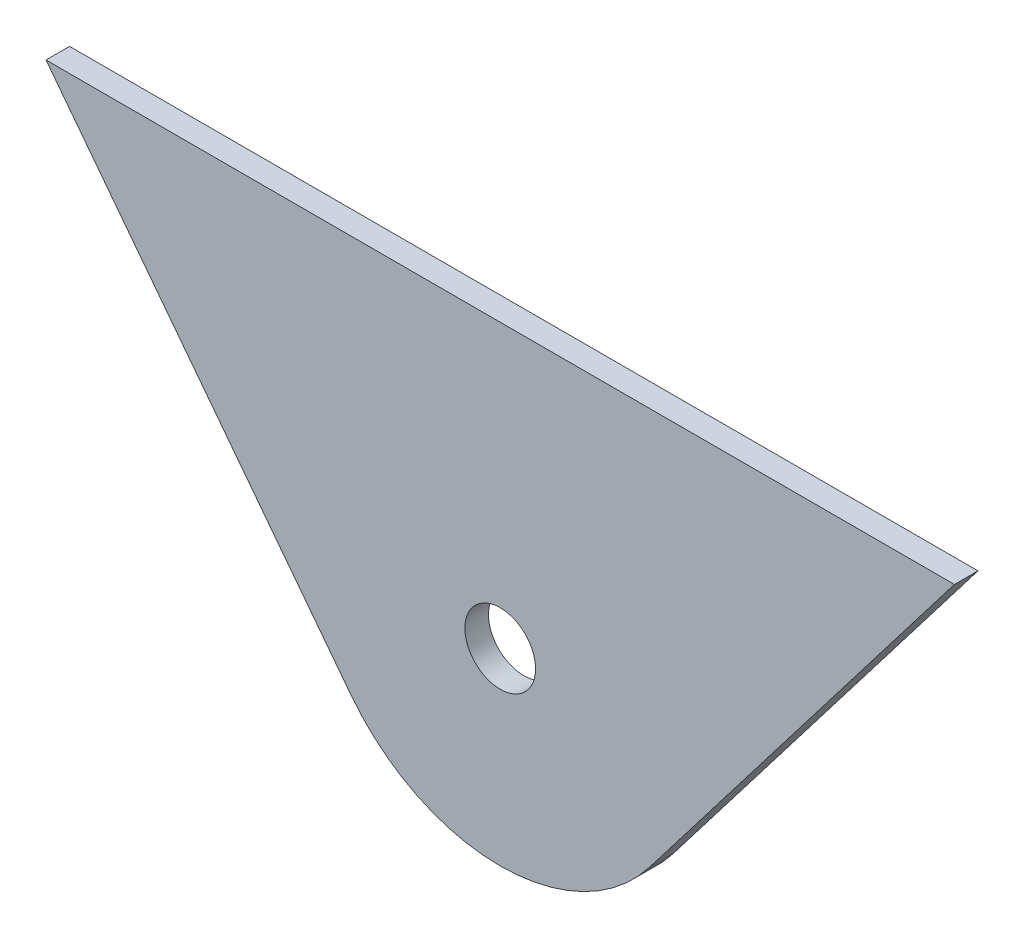
from build123d import *

# Parameters (mm, degrees)
BOSS_EXTRUDE1_DEPTH = 3.175
SKETCH2_R           = 4.7625
CUT_EXTRUDE1_DEPTH  = 73.203842884


with BuildPart() as part:
    # Sketch1 → Boss-Extrude1 (new body)
    with BuildSketch(Plane.XY):
        with BuildLine():
            Line((-20.151174843, -15.462540297), (-61.251157558, 38.1))
            Line((-61.251157558, 38.1), (61.251157558, 38.1))
            Line((61.251157558, 38.1), (20.151174843, -15.462540297))
            ThreePointArc((20.151174843, -15.462540297), (0, -25.4), (-20.151174843, -15.462540297))
        make_face()
    extrude(amount=BOSS_EXTRUDE1_DEPTH)

    # Sketch2 → Cut-Extrude1 (cut, through all)
    with BuildSketch(Plane.XY.offset(3.175)):
        Circle(SKETCH2_R)
    extrude(amount=-CUT_EXTRUDE1_DEPTH, mode=Mode.SUBTRACT)


solid = part.part
